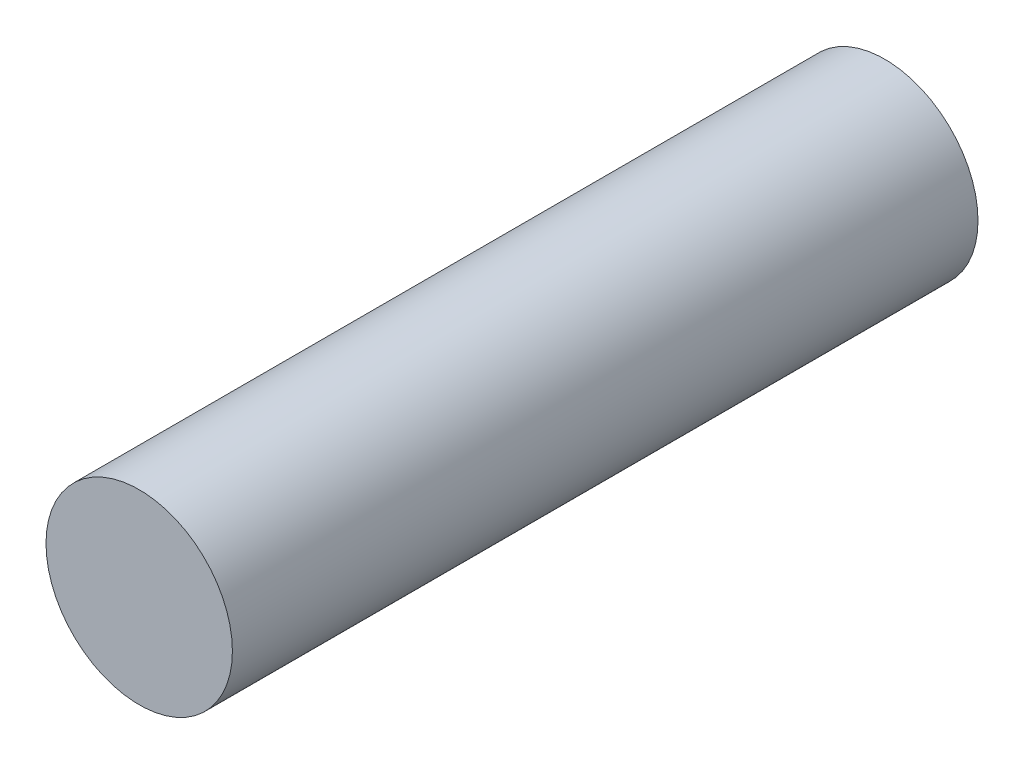
from build123d import *

# Parameters (mm, degrees)
SKETCH1_R           = 12.5
BOSS_EXTRUDE1_DEPTH = 100


with BuildPart() as part:
    # Sketch1 → Boss-Extrude1 (new body)
    with BuildSketch(Plane.XY):
        Circle(SKETCH1_R)
    extrude(amount=BOSS_EXTRUDE1_DEPTH)


solid = part.part
